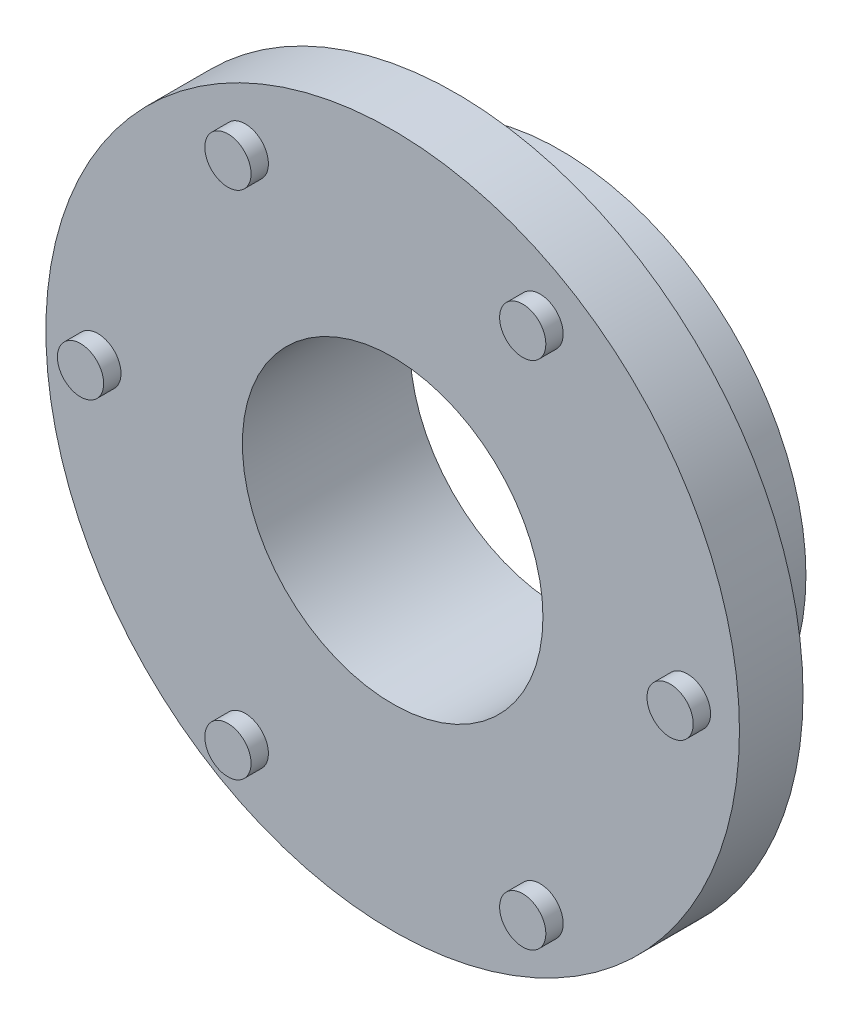
from build123d import *

# Parameters (mm, degrees)
SKETCH_1_R      = 85
SKETCH_1_R_2    = 52
EXTRUDE_1_DEPTH = 58
SKETCH_2_R      = 120
SKETCH_2_R_2    = 85
EXTRUDE_2_DEPTH = 22
SKETCH_3_R      = 8
EXTRUDE_3_DEPTH = 6


with BuildPart() as part:
    # 草图1 → 凸台-拉伸1 (new body)
    with BuildSketch(Plane.XY):
        Circle(SKETCH_1_R)
        Circle(SKETCH_1_R_2, mode=Mode.SUBTRACT)
    extrude(amount=-EXTRUDE_1_DEPTH)

    # 草图2 → 凸台-拉伸2 (add)
    with BuildSketch(Plane.XY):
        Circle(SKETCH_2_R)
        Circle(SKETCH_2_R_2, mode=Mode.SUBTRACT)
    extrude(amount=-EXTRUDE_2_DEPTH)

    # 草图3 → 凸台-拉伸3 (add)
    with BuildSketch(Plane.XY):
        with Locations((102, 0)):
            Circle(SKETCH_3_R)
        with Locations((51, 88.334591186)):
            Circle(SKETCH_3_R)
        with Locations((-51, 88.334591186)):
            Circle(SKETCH_3_R)
        with Locations((-102, 0)):
            Circle(SKETCH_3_R)
        with Locations((-51, -88.334591186)):
            Circle(SKETCH_3_R)
        with Locations((51, -88.334591186)):
            Circle(SKETCH_3_R)
    extrude(amount=EXTRUDE_3_DEPTH)


solid = part.part
